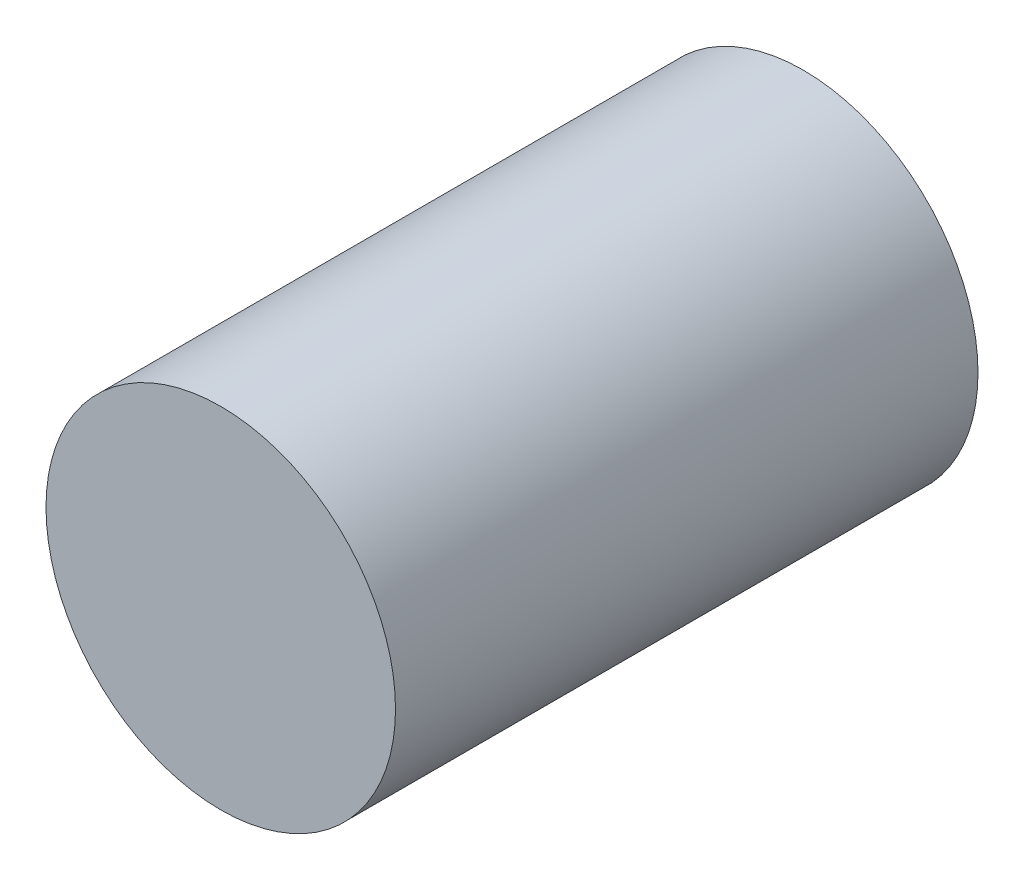
from build123d import *

# Parameters (mm, degrees)
SKETCH1_R           = 3
BOSS_EXTRUDE1_DEPTH = 10


with BuildPart() as part:
    # Sketch1 → Boss-Extrude1 (new body)
    with BuildSketch(Plane(origin=(0, 0, 0), x_dir=(0, 1, 0), z_dir=(0, 0, 1))):
        with Locations(Location((0, 0, 0), (0, 0, 270))):
            Circle(SKETCH1_R)
    extrude(amount=BOSS_EXTRUDE1_DEPTH)


solid = part.part
